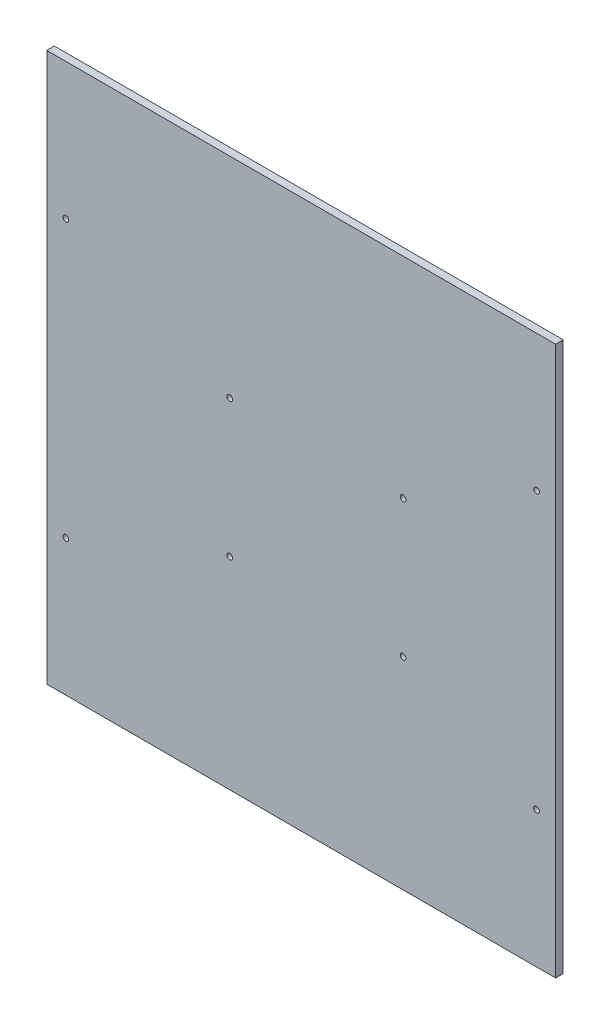
from build123d import *

# Parameters (mm, degrees)
ESQUISSE1_W      = 267
ESQUISSE1_H      = 288
ESQUISSE1_R      = 1.5
EXTRUSION1_DEPTH = 4
ESQUISSE2_R      = 1.5
EXTRUSION2_DEPTH = 10


with BuildPart() as part:
    # Esquisse1 → Extrusion1 (new body)
    with BuildSketch(Plane.XY):
        with Locations((123.5, 109.644166131)):
            Rectangle(ESQUISSE1_W, ESQUISSE1_H)
        with Locations((0, 182.144166131)):
            Circle(ESQUISSE1_R, mode=Mode.SUBTRACT)
        with Locations((0, 37.144166131)):
            Circle(ESQUISSE1_R, mode=Mode.SUBTRACT)
        with Locations((247, 37.144166131)):
            Circle(ESQUISSE1_R, mode=Mode.SUBTRACT)
        with Locations((247, 182.144166131)):
            Circle(ESQUISSE1_R, mode=Mode.SUBTRACT)
    extrude(amount=EXTRUSION1_DEPTH)

    # Esquisse2 → Extrusion2 (cut)
    with BuildSketch(Plane.XY.offset(4)):
        with Locations((86, 143.644166131)):
            Circle(ESQUISSE2_R)
        with Locations((177, 143.644166131)):
            Circle(ESQUISSE2_R)
        with Locations((177, 71.644166131)):
            Circle(ESQUISSE2_R)
        with Locations((86, 71.644166131)):
            Circle(ESQUISSE2_R)
    extrude(amount=-EXTRUSION2_DEPTH, mode=Mode.SUBTRACT)


solid = part.part
